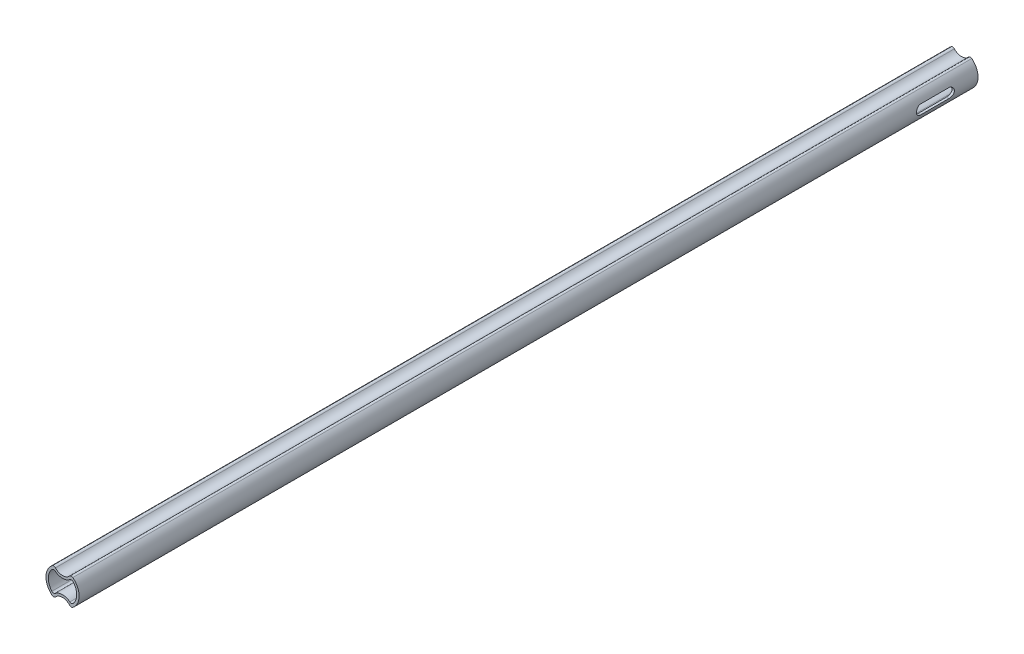
from build123d import *

# Parameters (mm, degrees)
ESTRUSIONE_ESTRUSIONE1_DEPTH = 190
TAGLIO_ESTRUSIONE1_DEPTH     = 190
TAGLIO_ESTRUSIONE2_DEPTH     = 191.053510761


with BuildPart() as part:
    # Schizzo1 → Estrusione-Estrusione1 (new body)
    with BuildSketch(Plane.XY):
        with BuildLine():
            ThreePointArc((2.184763914, -2.734375), (1.829579631, -2.841891076), (1.498123827, -2.675))
            ThreePointArc((1.498123827, -2.675), (0, -2), (-1.498123827, -2.675))
            ThreePointArc((-1.498123827, -2.675), (-1.829579631, -2.841891076), (-2.184763914, -2.734375))
            ThreePointArc((-2.184763914, -2.734375), (-3.5, 0), (-2.184763914, 2.734375))
            ThreePointArc((-2.184763914, 2.734375), (-1.829579631, 2.841891076), (-1.498123827, 2.675))
            ThreePointArc((-1.498123827, 2.675), (0, 2), (1.498123827, 2.675))
            ThreePointArc((1.498123827, 2.675), (1.829579631, 2.841891076), (2.184763914, 2.734375))
            ThreePointArc((2.184763914, 2.734375), (3.5, 0), (2.184763914, -2.734375))
        make_face()
        with BuildLine():
            ThreePointArc((-2.24718574, 1.9875), (-3, 0), (-2.24718574, -1.9875))
            ThreePointArc((-2.24718574, -1.9875), (-1.915729936, -2.154391076), (-1.560545653, -2.046875))
            ThreePointArc((-1.560545653, -2.046875), (0, -1.5), (1.560545653, -2.046875))
            ThreePointArc((1.560545653, -2.046875), (1.915729936, -2.154391076), (2.24718574, -1.9875))
            ThreePointArc((2.24718574, -1.9875), (3, 0), (2.24718574, 1.9875))
            ThreePointArc((2.24718574, 1.9875), (1.915729936, 2.154391076), (1.560545653, 2.046875))
            ThreePointArc((1.560545653, 2.046875), (0, 1.5), (-1.560545653, 2.046875))
            ThreePointArc((-1.560545653, 2.046875), (-1.915729936, 2.154391076), (-2.24718574, 1.9875))
        make_face(mode=Mode.SUBTRACT)
    extrude(amount=ESTRUSIONE_ESTRUSIONE1_DEPTH)

    # Schizzo2 → Taglio-Estrusione1 (cut)
    with BuildSketch(Plane(origin=(0, 0, 0), x_dir=(0, 0, -1), z_dir=(1, 0, 0))):
        with BuildLine():
            Line((-149.5, 0.5), (-130.5, 0.5))
            ThreePointArc((-130.5, 0.5), (-130, 0), (-130.5, -0.5))
            Line((-130.5, -0.5), (-149.5, -0.5))
            ThreePointArc((-149.5, -0.5), (-150, 0), (-149.5, 0.5))
        make_face()
    extrude(amount=-TAGLIO_ESTRUSIONE1_DEPTH, mode=Mode.SUBTRACT)

    # Schizzo3 → Taglio-Estrusione2 (cut, through all)
    with BuildSketch(Plane(origin=(0, 0, 0), x_dir=(0, 0, -1), z_dir=(1, 0, 0))):
        with BuildLine():
            Line((-12, 1), (-6, 1))
            ThreePointArc((-6, 1), (-5, 0), (-6, -1))
            Line((-6, -1), (-12, -1))
            ThreePointArc((-12, -1), (-13, 0), (-12, 1))
        make_face()
    extrude(amount=TAGLIO_ESTRUSIONE2_DEPTH, mode=Mode.SUBTRACT)


solid = part.part
